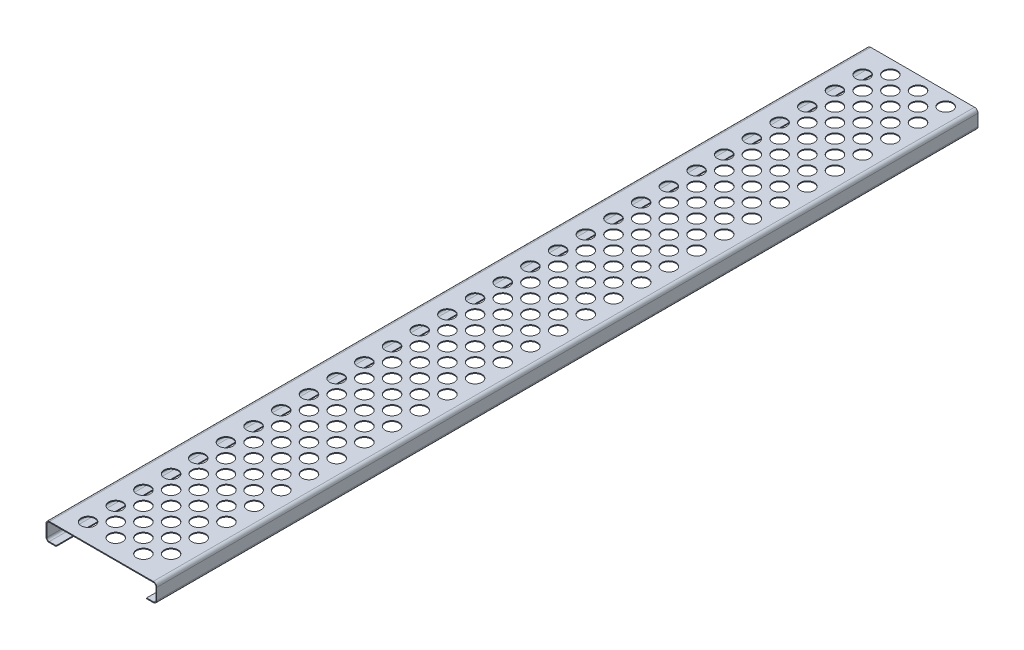
from build123d import *

# Parameters (mm, degrees)
BOSS_EXTRUDE1_DEPTH = 2260.6
SKETCH3_R           = 19.05
CUT_EXTRUDE2_DEPTH  = 2267.300677315


with BuildPart() as part:
    # Sketch1 → Boss-Extrude1 (new body)
    with BuildSketch(Plane.XY):
        with BuildLine():
            Line((-143.66875, 23.01875), (143.66875, 23.01875))
            ThreePointArc((143.66875, 23.01875), (148.158878061, 21.158878061), (150.01875, 16.66875))
            Line((150.01875, 16.66875), (150.01875, -16.66875))
            ThreePointArc((150.01875, -16.66875), (148.158878061, -21.158878061), (143.66875, -23.01875))
            Line((143.66875, -23.01875), (124.61875, -23.01875))
            Line((124.61875, -23.01875), (124.61875, -25.4))
            Line((124.61875, -25.4), (142.875, -25.4))
            ThreePointArc((142.875, -25.4), (149.610192091, -22.610192091), (152.4, -15.875))
            Line((152.4, -15.875), (152.4, 15.875))
            ThreePointArc((152.4, 15.875), (149.610192091, 22.610192091), (142.875, 25.4))
            Line((142.875, 25.4), (-142.875, 25.4))
            ThreePointArc((-142.875, 25.4), (-149.610192091, 22.610192091), (-152.4, 15.875))
            Line((-152.4, 15.875), (-152.4, -15.875))
            ThreePointArc((-152.4, -15.875), (-149.610192091, -22.610192091), (-142.875, -25.4))
            Line((-142.875, -25.4), (-124.61875, -25.4))
            Line((-124.61875, -25.4), (-124.61875, -23.01875))
            Line((-124.61875, -23.01875), (-143.66875, -23.01875))
            ThreePointArc((-143.66875, -23.01875), (-148.158878061, -21.158878061), (-150.01875, -16.66875))
            Line((-150.01875, -16.66875), (-150.01875, 16.66875))
            ThreePointArc((-150.01875, 16.66875), (-148.158878061, 21.158878061), (-143.66875, 23.01875))
        make_face()
    extrude(amount=BOSS_EXTRUDE1_DEPTH)

    # Sketch3 → Cut-Extrude2 (cut, through all)
    with BuildSketch(Plane(origin=(0, 25.4, 0), x_dir=(1, 0, 0), z_dir=(0, 1, 0))):
        with Locations(Location((101.6, -38.1, 0), (0, 0, 270))):
            Circle(SKETCH3_R)
        with Locations(Location((63.5, -76.2, 0), (0, 0, 270))):
            Circle(SKETCH3_R)
        with Locations(Location((-12.7, -76.2, 0), (0, 0, 270))):
            Circle(SKETCH3_R)
        with Locations(Location((25.4, -38.1, 0), (0, 0, 270))):
            Circle(SKETCH3_R)
        with Locations(Location((-88.9, -76.2, 0), (0, 0, 270))):
            Circle(SKETCH3_R)
        with Locations(Location((-50.8, -38.1, 0), (0, 0, 270))):
            Circle(SKETCH3_R)
        with Locations(Location((-12.7, -152.4, 0), (0, 0, 270))):
            Circle(SKETCH3_R)
        with Locations(Location((25.4, -114.3, 0), (0, 0, 270))):
            Circle(SKETCH3_R)
        with Locations(Location((-88.9, -152.4, 0), (0, 0, 270))):
            Circle(SKETCH3_R)
        with Locations(Location((-50.8, -114.3, 0), (0, 0, 270))):
            Circle(SKETCH3_R)
        with Locations(Location((-12.7, -228.6, 0), (0, 0, 270))):
            Circle(SKETCH3_R)
        with Locations(Location((25.4, -190.5, 0), (0, 0, 270))):
            Circle(SKETCH3_R)
        with Locations(Location((-88.9, -228.6, 0), (0, 0, 270))):
            Circle(SKETCH3_R)
        with Locations(Location((-50.8, -190.5, 0), (0, 0, 270))):
            Circle(SKETCH3_R)
        with Locations(Location((-12.7, -304.8, 0), (0, 0, 270))):
            Circle(SKETCH3_R)
        with Locations(Location((25.4, -266.7, 0), (0, 0, 270))):
            Circle(SKETCH3_R)
        with Locations(Location((-88.9, -304.8, 0), (0, 0, 270))):
            Circle(SKETCH3_R)
        with Locations(Location((-50.8, -266.7, 0), (0, 0, 270))):
            Circle(SKETCH3_R)
        with Locations(Location((-12.7, -381, 0), (0, 0, 270))):
            Circle(SKETCH3_R)
        with Locations(Location((25.4, -342.9, 0), (0, 0, 270))):
            Circle(SKETCH3_R)
        with Locations(Location((-88.9, -381, 0), (0, 0, 270))):
            Circle(SKETCH3_R)
        with Locations(Location((-50.8, -342.9, 0), (0, 0, 270))):
            Circle(SKETCH3_R)
        with Locations(Location((-12.7, -457.2, 0), (0, 0, 270))):
            Circle(SKETCH3_R)
        with Locations(Location((25.4, -419.1, 0), (0, 0, 270))):
            Circle(SKETCH3_R)
        with Locations(Location((-88.9, -457.2, 0), (0, 0, 270))):
            Circle(SKETCH3_R)
        with Locations(Location((-50.8, -419.1, 0), (0, 0, 270))):
            Circle(SKETCH3_R)
        with Locations(Location((-12.7, -533.4, 0), (0, 0, 270))):
            Circle(SKETCH3_R)
        with Locations(Location((25.4, -495.3, 0), (0, 0, 270))):
            Circle(SKETCH3_R)
        with Locations(Location((-88.9, -533.4, 0), (0, 0, 270))):
            Circle(SKETCH3_R)
        with Locations(Location((-50.8, -495.3, 0), (0, 0, 270))):
            Circle(SKETCH3_R)
        with Locations(Location((-12.7, -609.6, 0), (0, 0, 270))):
            Circle(SKETCH3_R)
        with Locations(Location((25.4, -571.5, 0), (0, 0, 270))):
            Circle(SKETCH3_R)
        with Locations(Location((-88.9, -609.6, 0), (0, 0, 270))):
            Circle(SKETCH3_R)
        with Locations(Location((-50.8, -571.5, 0), (0, 0, 270))):
            Circle(SKETCH3_R)
        with Locations(Location((-12.7, -685.8, 0), (0, 0, 270))):
            Circle(SKETCH3_R)
        with Locations(Location((25.4, -647.7, 0), (0, 0, 270))):
            Circle(SKETCH3_R)
        with Locations(Location((-88.9, -685.8, 0), (0, 0, 270))):
            Circle(SKETCH3_R)
        with Locations(Location((-50.8, -647.7, 0), (0, 0, 270))):
            Circle(SKETCH3_R)
        with Locations(Location((-12.7, -762, 0), (0, 0, 270))):
            Circle(SKETCH3_R)
        with Locations(Location((25.4, -723.9, 0), (0, 0, 270))):
            Circle(SKETCH3_R)
        with Locations(Location((-88.9, -762, 0), (0, 0, 270))):
            Circle(SKETCH3_R)
        with Locations(Location((-50.8, -723.9, 0), (0, 0, 270))):
            Circle(SKETCH3_R)
        with Locations(Location((-12.7, -838.2, 0), (0, 0, 270))):
            Circle(SKETCH3_R)
        with Locations(Location((25.4, -800.1, 0), (0, 0, 270))):
            Circle(SKETCH3_R)
        with Locations(Location((-88.9, -838.2, 0), (0, 0, 270))):
            Circle(SKETCH3_R)
        with Locations(Location((-50.8, -800.1, 0), (0, 0, 270))):
            Circle(SKETCH3_R)
        with Locations(Location((-12.7, -914.4, 0), (0, 0, 270))):
            Circle(SKETCH3_R)
        with Locations(Location((25.4, -876.3, 0), (0, 0, 270))):
            Circle(SKETCH3_R)
        with Locations(Location((-88.9, -914.4, 0), (0, 0, 270))):
            Circle(SKETCH3_R)
        with Locations(Location((-50.8, -876.3, 0), (0, 0, 270))):
            Circle(SKETCH3_R)
        with Locations(Location((-12.7, -990.6, 0), (0, 0, 270))):
            Circle(SKETCH3_R)
        with Locations(Location((25.4, -952.5, 0), (0, 0, 270))):
            Circle(SKETCH3_R)
        with Locations(Location((-88.9, -990.6, 0), (0, 0, 270))):
            Circle(SKETCH3_R)
        with Locations(Location((-50.8, -952.5, 0), (0, 0, 270))):
            Circle(SKETCH3_R)
        with Locations(Location((-12.7, -1066.8, 0), (0, 0, 270))):
            Circle(SKETCH3_R)
        with Locations(Location((25.4, -1028.7, 0), (0, 0, 270))):
            Circle(SKETCH3_R)
        with Locations(Location((-88.9, -1066.8, 0), (0, 0, 270))):
            Circle(SKETCH3_R)
        with Locations(Location((-50.8, -1028.7, 0), (0, 0, 270))):
            Circle(SKETCH3_R)
        with Locations(Location((-12.7, -1143, 0), (0, 0, 270))):
            Circle(SKETCH3_R)
        with Locations(Location((25.4, -1104.9, 0), (0, 0, 270))):
            Circle(SKETCH3_R)
        with Locations(Location((-88.9, -1143, 0), (0, 0, 270))):
            Circle(SKETCH3_R)
        with Locations(Location((-50.8, -1104.9, 0), (0, 0, 270))):
            Circle(SKETCH3_R)
        with Locations(Location((-12.7, -1219.2, 0), (0, 0, 270))):
            Circle(SKETCH3_R)
        with Locations(Location((25.4, -1181.1, 0), (0, 0, 270))):
            Circle(SKETCH3_R)
        with Locations(Location((-88.9, -1219.2, 0), (0, 0, 270))):
            Circle(SKETCH3_R)
        with Locations(Location((-50.8, -1181.1, 0), (0, 0, 270))):
            Circle(SKETCH3_R)
        with Locations(Location((-12.7, -1295.4, 0), (0, 0, 270))):
            Circle(SKETCH3_R)
        with Locations(Location((25.4, -1257.3, 0), (0, 0, 270))):
            Circle(SKETCH3_R)
        with Locations(Location((-88.9, -1295.4, 0), (0, 0, 270))):
            Circle(SKETCH3_R)
        with Locations(Location((-50.8, -1257.3, 0), (0, 0, 270))):
            Circle(SKETCH3_R)
        with Locations(Location((-12.7, -1371.6, 0), (0, 0, 270))):
            Circle(SKETCH3_R)
        with Locations(Location((25.4, -1333.5, 0), (0, 0, 270))):
            Circle(SKETCH3_R)
        with Locations(Location((-88.9, -1371.6, 0), (0, 0, 270))):
            Circle(SKETCH3_R)
        with Locations(Location((-50.8, -1333.5, 0), (0, 0, 270))):
            Circle(SKETCH3_R)
        with Locations(Location((-12.7, -1447.8, 0), (0, 0, 270))):
            Circle(SKETCH3_R)
        with Locations(Location((25.4, -1409.7, 0), (0, 0, 270))):
            Circle(SKETCH3_R)
        with Locations(Location((-88.9, -1447.8, 0), (0, 0, 270))):
            Circle(SKETCH3_R)
        with Locations(Location((-50.8, -1409.7, 0), (0, 0, 270))):
            Circle(SKETCH3_R)
        with Locations(Location((-12.7, -1524, 0), (0, 0, 270))):
            Circle(SKETCH3_R)
        with Locations(Location((25.4, -1485.9, 0), (0, 0, 270))):
            Circle(SKETCH3_R)
        with Locations(Location((-88.9, -1524, 0), (0, 0, 270))):
            Circle(SKETCH3_R)
        with Locations(Location((-50.8, -1485.9, 0), (0, 0, 270))):
            Circle(SKETCH3_R)
        with Locations(Location((-12.7, -1600.2, 0), (0, 0, 270))):
            Circle(SKETCH3_R)
        with Locations(Location((25.4, -1562.1, 0), (0, 0, 270))):
            Circle(SKETCH3_R)
        with Locations(Location((-88.9, -1600.2, 0), (0, 0, 270))):
            Circle(SKETCH3_R)
        with Locations(Location((-50.8, -1562.1, 0), (0, 0, 270))):
            Circle(SKETCH3_R)
        with Locations(Location((-12.7, -1676.4, 0), (0, 0, 270))):
            Circle(SKETCH3_R)
        with Locations(Location((25.4, -1638.3, 0), (0, 0, 270))):
            Circle(SKETCH3_R)
        with Locations(Location((-88.9, -1676.4, 0), (0, 0, 270))):
            Circle(SKETCH3_R)
        with Locations(Location((-50.8, -1638.3, 0), (0, 0, 270))):
            Circle(SKETCH3_R)
        with Locations(Location((-12.7, -1752.6, 0), (0, 0, 270))):
            Circle(SKETCH3_R)
        with Locations(Location((25.4, -1714.5, 0), (0, 0, 270))):
            Circle(SKETCH3_R)
        with Locations(Location((-88.9, -1752.6, 0), (0, 0, 270))):
            Circle(SKETCH3_R)
        with Locations(Location((-50.8, -1714.5, 0), (0, 0, 270))):
            Circle(SKETCH3_R)
        with Locations(Location((-12.7, -1828.8, 0), (0, 0, 270))):
            Circle(SKETCH3_R)
        with Locations(Location((25.4, -1790.7, 0), (0, 0, 270))):
            Circle(SKETCH3_R)
        with Locations(Location((-88.9, -1828.8, 0), (0, 0, 270))):
            Circle(SKETCH3_R)
        with Locations(Location((-50.8, -1790.7, 0), (0, 0, 270))):
            Circle(SKETCH3_R)
        with Locations(Location((-12.7, -1905, 0), (0, 0, 270))):
            Circle(SKETCH3_R)
        with Locations(Location((25.4, -1866.9, 0), (0, 0, 270))):
            Circle(SKETCH3_R)
        with Locations(Location((-88.9, -1905, 0), (0, 0, 270))):
            Circle(SKETCH3_R)
        with Locations(Location((-50.8, -1866.9, 0), (0, 0, 270))):
            Circle(SKETCH3_R)
        with Locations(Location((63.5, -152.4, 0), (0, 0, 270))):
            Circle(SKETCH3_R)
        with Locations(Location((101.6, -114.3, 0), (0, 0, 270))):
            Circle(SKETCH3_R)
        with Locations(Location((63.5, -228.6, 0), (0, 0, 270))):
            Circle(SKETCH3_R)
        with Locations(Location((101.6, -190.5, 0), (0, 0, 270))):
            Circle(SKETCH3_R)
        with Locations(Location((63.5, -304.8, 0), (0, 0, 270))):
            Circle(SKETCH3_R)
        with Locations(Location((101.6, -266.7, 0), (0, 0, 270))):
            Circle(SKETCH3_R)
        with Locations(Location((63.5, -381, 0), (0, 0, 270))):
            Circle(SKETCH3_R)
        with Locations(Location((101.6, -342.9, 0), (0, 0, 270))):
            Circle(SKETCH3_R)
        with Locations(Location((63.5, -457.2, 0), (0, 0, 270))):
            Circle(SKETCH3_R)
        with Locations(Location((101.6, -419.1, 0), (0, 0, 270))):
            Circle(SKETCH3_R)
        with Locations(Location((63.5, -533.4, 0), (0, 0, 270))):
            Circle(SKETCH3_R)
        with Locations(Location((101.6, -495.3, 0), (0, 0, 270))):
            Circle(SKETCH3_R)
        with Locations(Location((63.5, -609.6, 0), (0, 0, 270))):
            Circle(SKETCH3_R)
        with Locations(Location((101.6, -571.5, 0), (0, 0, 270))):
            Circle(SKETCH3_R)
        with Locations(Location((63.5, -685.8, 0), (0, 0, 270))):
            Circle(SKETCH3_R)
        with Locations(Location((101.6, -647.7, 0), (0, 0, 270))):
            Circle(SKETCH3_R)
        with Locations(Location((63.5, -762, 0), (0, 0, 270))):
            Circle(SKETCH3_R)
        with Locations(Location((101.6, -723.9, 0), (0, 0, 270))):
            Circle(SKETCH3_R)
        with Locations(Location((63.5, -838.2, 0), (0, 0, 270))):
            Circle(SKETCH3_R)
        with Locations(Location((101.6, -800.1, 0), (0, 0, 270))):
            Circle(SKETCH3_R)
        with Locations(Location((63.5, -914.4, 0), (0, 0, 270))):
            Circle(SKETCH3_R)
        with Locations(Location((101.6, -876.3, 0), (0, 0, 270))):
            Circle(SKETCH3_R)
        with Locations(Location((63.5, -990.6, 0), (0, 0, 270))):
            Circle(SKETCH3_R)
        with Locations(Location((101.6, -952.5, 0), (0, 0, 270))):
            Circle(SKETCH3_R)
        with Locations(Location((63.5, -1066.8, 0), (0, 0, 270))):
            Circle(SKETCH3_R)
        with Locations(Location((101.6, -1028.7, 0), (0, 0, 270))):
            Circle(SKETCH3_R)
        with Locations(Location((63.5, -1143, 0), (0, 0, 270))):
            Circle(SKETCH3_R)
        with Locations(Location((101.6, -1104.9, 0), (0, 0, 270))):
            Circle(SKETCH3_R)
        with Locations(Location((63.5, -1219.2, 0), (0, 0, 270))):
            Circle(SKETCH3_R)
        with Locations(Location((101.6, -1181.1, 0), (0, 0, 270))):
            Circle(SKETCH3_R)
        with Locations(Location((63.5, -1295.4, 0), (0, 0, 270))):
            Circle(SKETCH3_R)
        with Locations(Location((101.6, -1257.3, 0), (0, 0, 270))):
            Circle(SKETCH3_R)
        with Locations(Location((63.5, -1371.6, 0), (0, 0, 270))):
            Circle(SKETCH3_R)
        with Locations(Location((101.6, -1333.5, 0), (0, 0, 270))):
            Circle(SKETCH3_R)
        with Locations(Location((63.5, -1447.8, 0), (0, 0, 270))):
            Circle(SKETCH3_R)
        with Locations(Location((101.6, -1409.7, 0), (0, 0, 270))):
            Circle(SKETCH3_R)
        with Locations(Location((63.5, -1524, 0), (0, 0, 270))):
            Circle(SKETCH3_R)
        with Locations(Location((101.6, -1485.9, 0), (0, 0, 270))):
            Circle(SKETCH3_R)
        with Locations(Location((63.5, -1600.2, 0), (0, 0, 270))):
            Circle(SKETCH3_R)
        with Locations(Location((101.6, -1562.1, 0), (0, 0, 270))):
            Circle(SKETCH3_R)
        with Locations(Location((63.5, -1676.4, 0), (0, 0, 270))):
            Circle(SKETCH3_R)
        with Locations(Location((101.6, -1638.3, 0), (0, 0, 270))):
            Circle(SKETCH3_R)
        with Locations(Location((63.5, -1752.6, 0), (0, 0, 270))):
            Circle(SKETCH3_R)
        with Locations(Location((101.6, -1714.5, 0), (0, 0, 270))):
            Circle(SKETCH3_R)
        with Locations(Location((63.5, -1828.8, 0), (0, 0, 270))):
            Circle(SKETCH3_R)
        with Locations(Location((101.6, -1790.7, 0), (0, 0, 270))):
            Circle(SKETCH3_R)
        with Locations(Location((63.5, -1905, 0), (0, 0, 270))):
            Circle(SKETCH3_R)
        with Locations(Location((101.6, -1866.9, 0), (0, 0, 270))):
            Circle(SKETCH3_R)
        with Locations(Location((-12.7, -1979.735057736, 0), (0, 0, 270))):
            Circle(SKETCH3_R)
        with Locations(Location((25.4, -1941.635057736, 0), (0, 0, 270))):
            Circle(SKETCH3_R)
        with Locations(Location((-88.9, -1979.735057736, 0), (0, 0, 270))):
            Circle(SKETCH3_R)
        with Locations(Location((-50.8, -1941.635057736, 0), (0, 0, 270))):
            Circle(SKETCH3_R)
        with Locations(Location((-12.7, -2055.935057736, 0), (0, 0, 270))):
            Circle(SKETCH3_R)
        with Locations(Location((25.4, -2017.835057736, 0), (0, 0, 270))):
            Circle(SKETCH3_R)
        with Locations(Location((-88.9, -2055.935057736, 0), (0, 0, 270))):
            Circle(SKETCH3_R)
        with Locations(Location((-50.8, -2017.835057736, 0), (0, 0, 270))):
            Circle(SKETCH3_R)
        with Locations(Location((-12.7, -2132.135057736, 0), (0, 0, 270))):
            Circle(SKETCH3_R)
        with Locations(Location((25.4, -2094.035057736, 0), (0, 0, 270))):
            Circle(SKETCH3_R)
        with Locations(Location((-88.9, -2132.135057736, 0), (0, 0, 270))):
            Circle(SKETCH3_R)
        with Locations(Location((-50.8, -2094.035057736, 0), (0, 0, 270))):
            Circle(SKETCH3_R)
        with Locations(Location((-12.7, -2208.335057736, 0), (0, 0, 270))):
            Circle(SKETCH3_R)
        with Locations(Location((25.4, -2170.235057736, 0), (0, 0, 270))):
            Circle(SKETCH3_R)
        with Locations(Location((-88.9, -2208.335057736, 0), (0, 0, 270))):
            Circle(SKETCH3_R)
        with Locations(Location((-50.8, -2170.235057736, 0), (0, 0, 270))):
            Circle(SKETCH3_R)
        with Locations(Location((63.5, -1979.735057736, 0), (0, 0, 270))):
            Circle(SKETCH3_R)
        with Locations(Location((101.6, -1941.635057736, 0), (0, 0, 270))):
            Circle(SKETCH3_R)
        with Locations(Location((63.5, -2055.935057736, 0), (0, 0, 270))):
            Circle(SKETCH3_R)
        with Locations(Location((101.6, -2017.835057736, 0), (0, 0, 270))):
            Circle(SKETCH3_R)
        with Locations(Location((63.5, -2132.135057736, 0), (0, 0, 270))):
            Circle(SKETCH3_R)
        with Locations(Location((101.6, -2094.035057736, 0), (0, 0, 270))):
            Circle(SKETCH3_R)
        with Locations(Location((63.5, -2208.335057736, 0), (0, 0, 270))):
            Circle(SKETCH3_R)
        with Locations(Location((101.6, -2170.235057736, 0), (0, 0, 270))):
            Circle(SKETCH3_R)
    extrude(amount=-CUT_EXTRUDE2_DEPTH, mode=Mode.SUBTRACT)


solid = part.part
